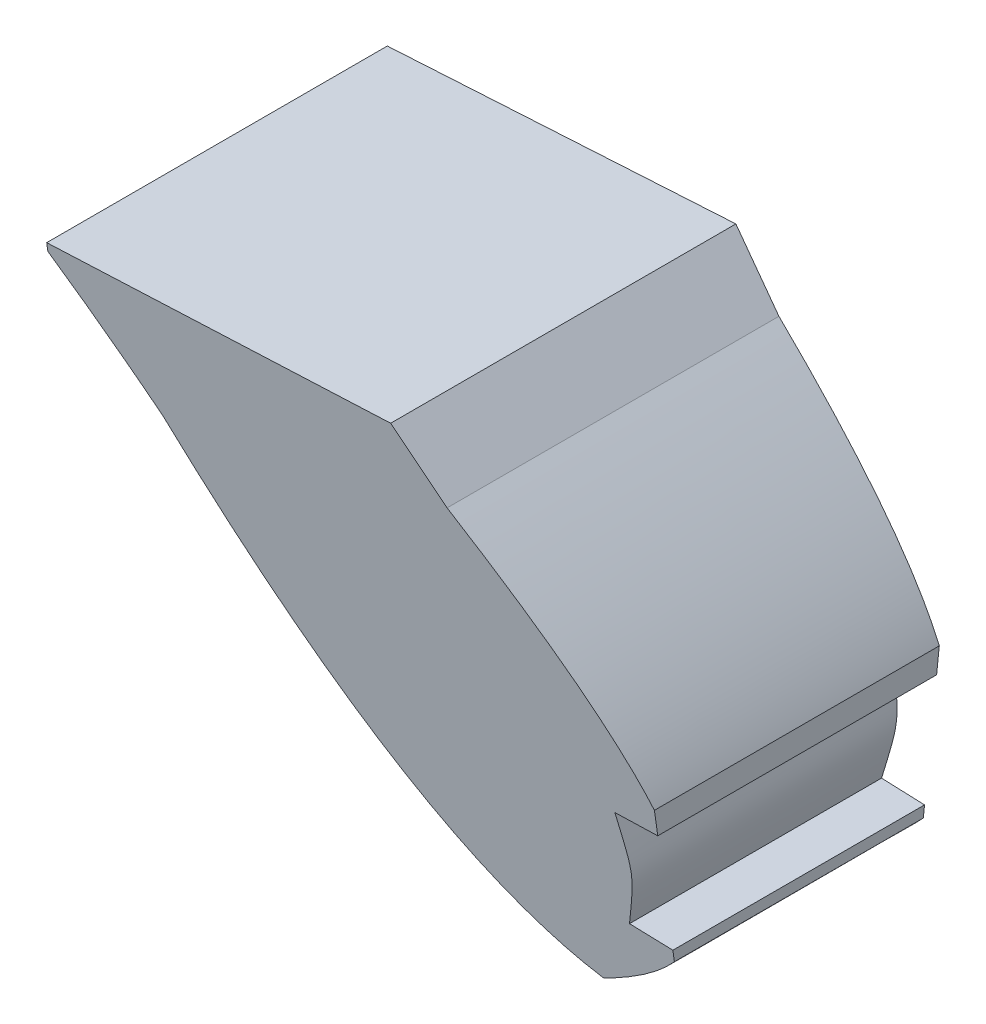
from build123d import *

# Parameters (mm, degrees)
SALIENTE_EXTRUIR1_DEPTH      = 7
SALIENTE_EXTRUIR2_DEPTH      = 7
SALIENTE_EXTRUIR2_DEPTH_BACK = 7
CORTAR_EXTRUIR2_DEPTH        = 28.177550449
CORTAR_EXTRUIR2_DEPTH_BACK   = 28.177550449


with BuildPart() as part:
    # Croquis1 → Saliente-Extruir1 (new, symmetric)
    with BuildSketch(Plane.XY):
        with BuildLine():
            add(Edge.make_bspline(
                [(-18.945192114, 7.540918896), (-10.215008384, -3.697644103), (-2.846604825, -5.059081104)],
                knots=[0.497667241, 0.497667241, 0.497667241, 0.49955428, 0.49955428, 0.49955428], degree=2, weights=[1, 1, 1]))
            add(Edge.make_bspline(
                [(-2.846604825, -5.059081104), (-0.742366882, -3.9352066), (0.355125, -2.723253227)],
                knots=[0.498812075, 0.498812075, 0.498812075, 0.499412845, 0.499412845, 0.499412845], degree=2, weights=[1, 1, 1]))
            Line((0.355125, -2.723253227), (0.355125, -2.284841781))
            Line((0.355125, -2.284841781), (-1.394875, -2.223730435))
            add(Edge.make_bspline(
                [(-1.394875, -2.223730435), (-0.90753067, -0.123730435), (-1.394875, 1.976269565)],
                knots=[0, 0, 0, 1, 1, 1], degree=2, weights=[1, 3.231801219, 1]))
            Line((-1.394875, 1.976269565), (0.355125, 2.284841781))
            Line((0.355125, 2.284841781), (0.355125, 3.001549529))
            add(Edge.make_bspline(
                [(0.355125, 3.001549529), (-1.44872627, 6.058427314), (-6.994875026, 10.477389992)],
                knots=[0.500820705, 0.500820705, 0.500820705, 0.502013312, 0.502013312, 0.502013312], degree=2, weights=[1, 1, 1]))
            Line((-6.994875026, 10.477389992), (-8.981845695, 12.608155172))
            Line((-8.981845695, 12.608155172), (-23.035921146, 11.871612288))
            Line((-23.035921146, 11.871612288), (-23.035921146, 11.54013782))
            ThreePointArc((-23.035921146, 11.54013782), (-20.949684518, 9.582335705), (-18.945192114, 7.540918896))
        make_face()
    extrude(amount=SALIENTE_EXTRUIR1_DEPTH, both=True)

    # Croquis4 → Saliente-Extruir2 (add, two sides: drawn at the far end of the back side and taken through both)
    with BuildSketch(Plane.XY.offset(-SALIENTE_EXTRUIR2_DEPTH_BACK)):
        Polygon((-1.394875, 1.976269565), (0.355125, 2.284841781), (0.355125, 2.037380912), align=None)
    extrude(amount=SALIENTE_EXTRUIR2_DEPTH + SALIENTE_EXTRUIR2_DEPTH_BACK)

    # Croquis6 → Cortar-Extruir2 (cut, two sides: drawn at the far end of the back side and taken through both)
    with BuildSketch(Plane(origin=(0, 0, 0), x_dir=(0, 0, -1), z_dir=(1, 0, 0)).offset(-CORTAR_EXTRUIR2_DEPTH_BACK)):
        Polygon((7, 12.608155172), (7, -5.059081104), (5, -5.059081104), align=None)
        Polygon((-7, 12.608155172), (-7, -5.059081104), (-4.5, -5.059081104), align=None)
    extrude(amount=CORTAR_EXTRUIR2_DEPTH + CORTAR_EXTRUIR2_DEPTH_BACK, mode=Mode.SUBTRACT)


solid = part.part
